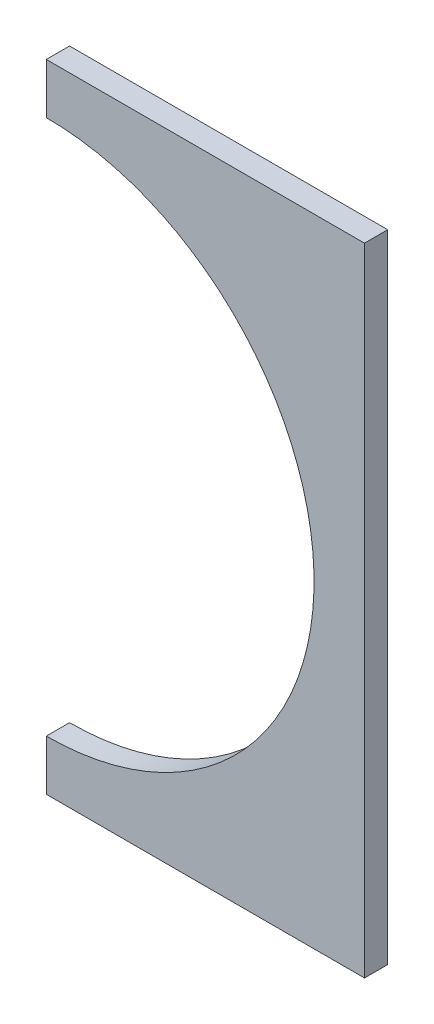
from build123d import *

# Parameters (mm, degrees)
EXTRUDE_1_DEPTH = 6


with BuildPart() as part:
    # Эскиз1 → Бобышка-Вытянуть1 (new body)
    with BuildSketch(Plane.XY):
        with BuildLine():
            Line((82.05, 82.05), (0, 82.05))
            Line((0, 82.05), (0, 69.05))
            ThreePointArc((0, 69.05), (48.825723241, 48.825723241), (69.05, 0))
            ThreePointArc((69.05, 0), (48.825723241, -48.825723241), (0, -69.05))
            Line((0, -69.05), (0, -82.05))
            Line((0, -82.05), (82.05, -82.05))
            Line((82.05, -82.05), (82.05, 82.05))
        make_face()
    extrude(amount=EXTRUDE_1_DEPTH)


solid = part.part
